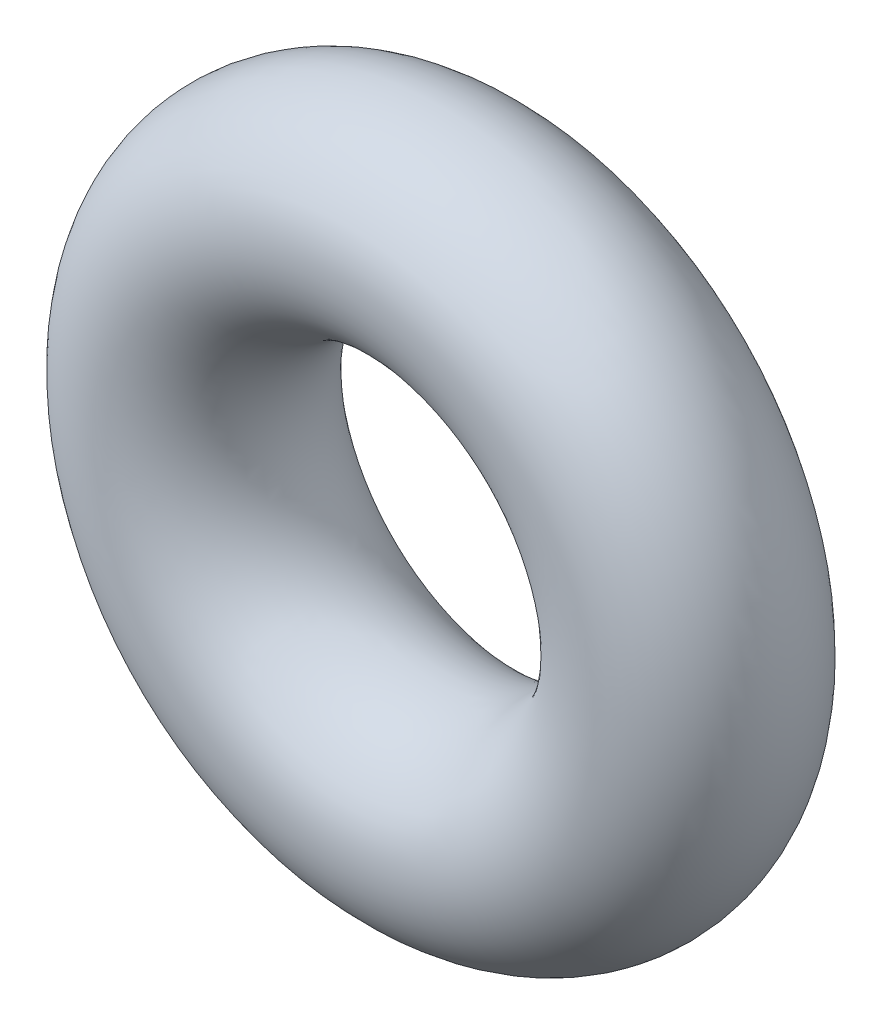
from build123d import *

# Parameters (mm, degrees)
SKETCH1_R = 0.8


with BuildPart() as part:
    # Sketch1 → Revolve1 (revolve)
    with BuildSketch(Plane(origin=(0, 0, 0), x_dir=(0, -1, 0), z_dir=(1, 0, 0))):
        with Locations((1.9, 0)):
            Circle(SKETCH1_R)
    revolve(axis=Axis((0, 0, 0.8), (0, 0, -1)))


solid = part.part
